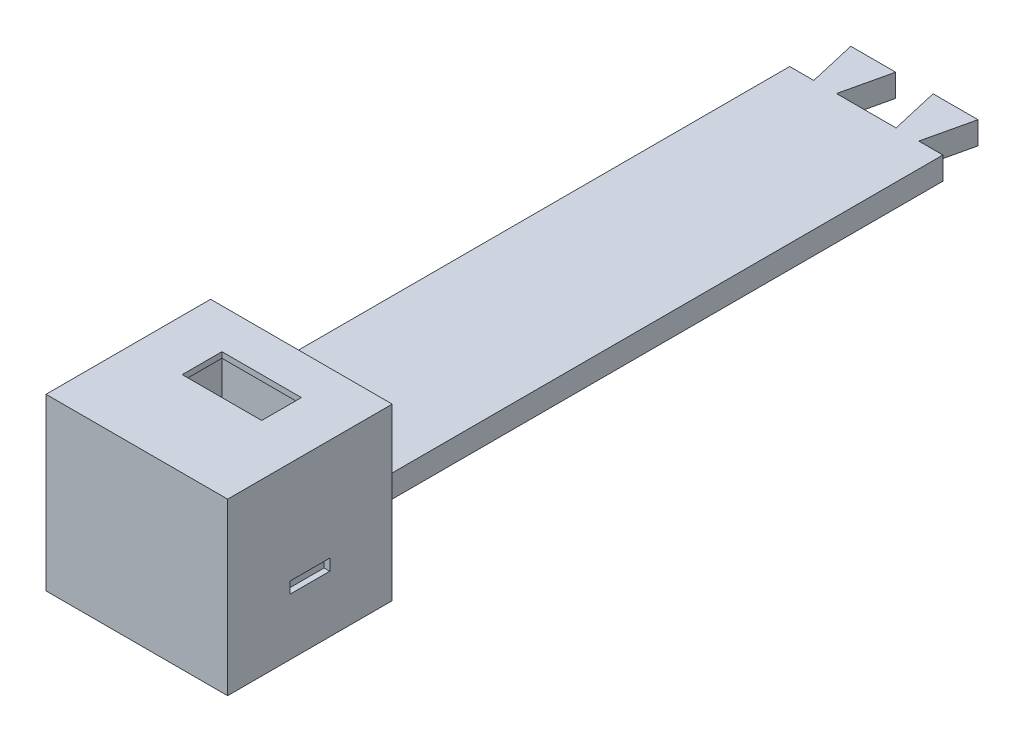
from build123d import *

# Parameters (mm, degrees)
ESQUISSE1_W             = 27
ESQUISSE1_H             = 4
BOSS_EXTRU_1_DEPTH      = 108
ENL_V_MAT_EXTRU_3_DEPTH = 109.913956865
ESQUISSE2_W             = 32
ESQUISSE2_H             = 30
BOSS_EXTRU_2_DEPTH      = 29
ESQUISSE17_W            = 27
ESQUISSE17_H            = 28
ENL_V_MAT_EXTRU_4_DEPTH = 29
ESQUISSE18_W            = 7
ESQUISSE18_H            = 2
ENL_V_MAT_EXTRU_6_DEPTH = 1
ESQUISSE24_W            = 7
ESQUISSE24_H            = 2
ENL_V_MAT_EXTRU_7_DEPTH = 1
ESQUISSE26_W            = 14
ESQUISSE26_H            = 7
ENL_V_MAT_EXTRU_8_DEPTH = 141.946798474


with BuildPart() as part:
    # Esquisse1 → Boss.-Extru.1 (new body)
    with BuildSketch(Plane.XY):
        Rectangle(ESQUISSE1_W, ESQUISSE1_H)
    extrude(amount=BOSS_EXTRU_1_DEPTH)

    # Esquisse12 → Enlèv. mat.-Extru.3 (cut, through all)
    with BuildSketch(Plane(origin=(0, 2, 0), x_dir=(1, 0, 0), z_dir=(0, 1, 0))):
        Polygon((-13.5, 0), (-11.207074173, 0), (-9.25, -8.477019564), (-13.5, -8.477019564), align=None)
        Polygon((-3.292925827, 0), (-5.25, -8.477019564), (5.25, -8.477019564), (3.292925827, 0), align=None)
        Polygon((11.207074173, 0), (9.25, -8.477019564), (13.5, -8.477019564), (13.5, 0), align=None)
    extrude(amount=-ENL_V_MAT_EXTRU_3_DEPTH, mode=Mode.SUBTRACT)

    # Esquisse2 → Boss.-Extru.2 (add)
    with BuildSketch(Plane.XY.offset(108)):
        Rectangle(ESQUISSE2_W, ESQUISSE2_H)
    extrude(amount=BOSS_EXTRU_2_DEPTH)

    # Esquisse17 → Enlèv. mat.-Extru.4 (cut)
    with BuildSketch(Plane.XZ.offset(15)):
        with Locations((0, 122.5)):
            Rectangle(ESQUISSE17_W, ESQUISSE17_H)
    extrude(amount=-ENL_V_MAT_EXTRU_4_DEPTH, mode=Mode.SUBTRACT)

    # Esquisse18 → Enlèv. mat.-Extru.6 (cut)
    with BuildSketch(Plane(origin=(16, 0, 0), x_dir=(0, 0, -1), z_dir=(1, 0, 0))):
        with Locations((-122.5, -4)):
            Rectangle(ESQUISSE18_W, ESQUISSE18_H)
    extrude(amount=-ENL_V_MAT_EXTRU_6_DEPTH, mode=Mode.SUBTRACT)

    # Esquisse24 → Enlèv. mat.-Extru.7 (cut)
    with BuildSketch(Plane.ZY.offset(16)):
        with Locations((122.5, -4)):
            Rectangle(ESQUISSE24_W, ESQUISSE24_H)
    extrude(amount=-ENL_V_MAT_EXTRU_7_DEPTH, mode=Mode.SUBTRACT)

    # Esquisse26 → Enlèv. mat.-Extru.8 (cut, through all)
    with BuildSketch(Plane.XZ.offset(-14)):
        with Locations((0, 118.5)):
            Rectangle(ESQUISSE26_W, ESQUISSE26_H)
    extrude(amount=-ENL_V_MAT_EXTRU_8_DEPTH, mode=Mode.SUBTRACT)


solid = part.part
